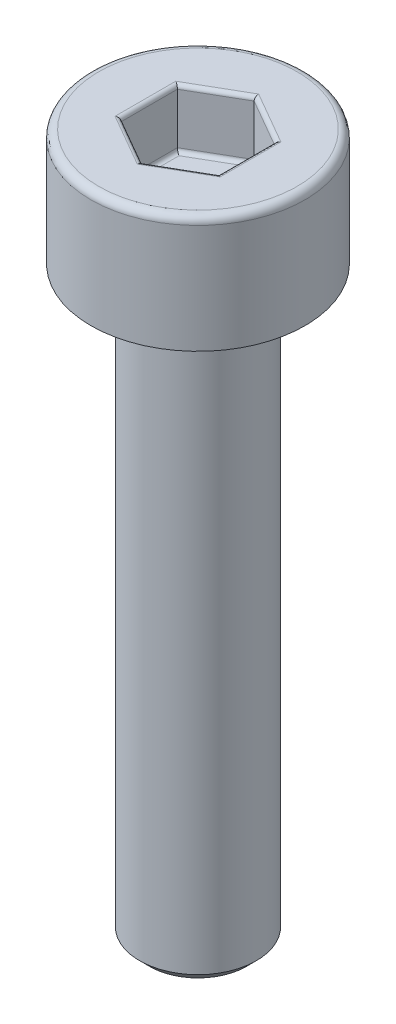
from build123d import *

# Parameters (mm, degrees)
CHAMFER1_SIZE      = 0.25
FILLET1_R          = 0.2
CUT_EXTRUDE1_DEPTH = 1.5
FILLET2_R          = 0.1


with BuildPart() as part:
    # Sketch1 → Revolve1 (revolve)
    with BuildSketch(Plane.XY, mode=Mode.PRIVATE) as revolve1_sk:
        Polygon((0, -18), (-1.5, -18), (-1.5, -3), (-2.75, -3), (-2.75, 0), (0, 0), align=None)
    revolve(revolve1_sk.sketch.rotate(Axis((0, 0, 0), (0, -1, 0)), 270), axis=Axis((0, 0, 0), (0, -1, 0)))

    # Chamfer1
    chamfer1_edges = [part.edges().sort_by_distance(p)[0] for p in [
        (0, -3, -1.5),
        (0, -18, -1.5),
    ]]
    chamfer(chamfer1_edges, length=CHAMFER1_SIZE)

    # Fillet1
    fillet1_edges = [part.edges().sort_by_distance(p)[0] for p in [
        (0, 0, -2.75),
    ]]
    fillet(fillet1_edges, radius=FILLET1_R)

    # Sketch2 → Cut-Extrude1 (cut)
    with BuildSketch(Plane(origin=(0, 0, 0), x_dir=(1, 0, 0), z_dir=(0, 1, 0))):
        Polygon((0, 1.443375673), (-1.25, 0.721687836), (-1.25, -0.721687836), (0, -1.443375673), (1.25, -0.721687836), (1.25, 0.721687836), align=None)
    extrude(amount=-CUT_EXTRUDE1_DEPTH, mode=Mode.SUBTRACT)

    # Fillet2
    fillet2_edges = [part.edges().sort_by_distance(p)[0] for p in [
        (0.625, -1.5, -1.082531755),
        (1.25, -1.5, 0),
        (0.625, -1.5, 1.082531755),
        (-0.625, -1.5, 1.082531755),
        (-1.25, -1.5, 0),
        (-0.625, -1.5, -1.082531755),
        (0.625, 0, -1.082531755),
        (-0.625, 0, -1.082531755),
        (-1.25, 0, 0),
        (-0.625, 0, 1.082531755),
        (0.625, 0, 1.082531755),
        (1.25, 0, 0),
    ]]
    fillet(fillet2_edges, radius=FILLET2_R)


solid = part.part
